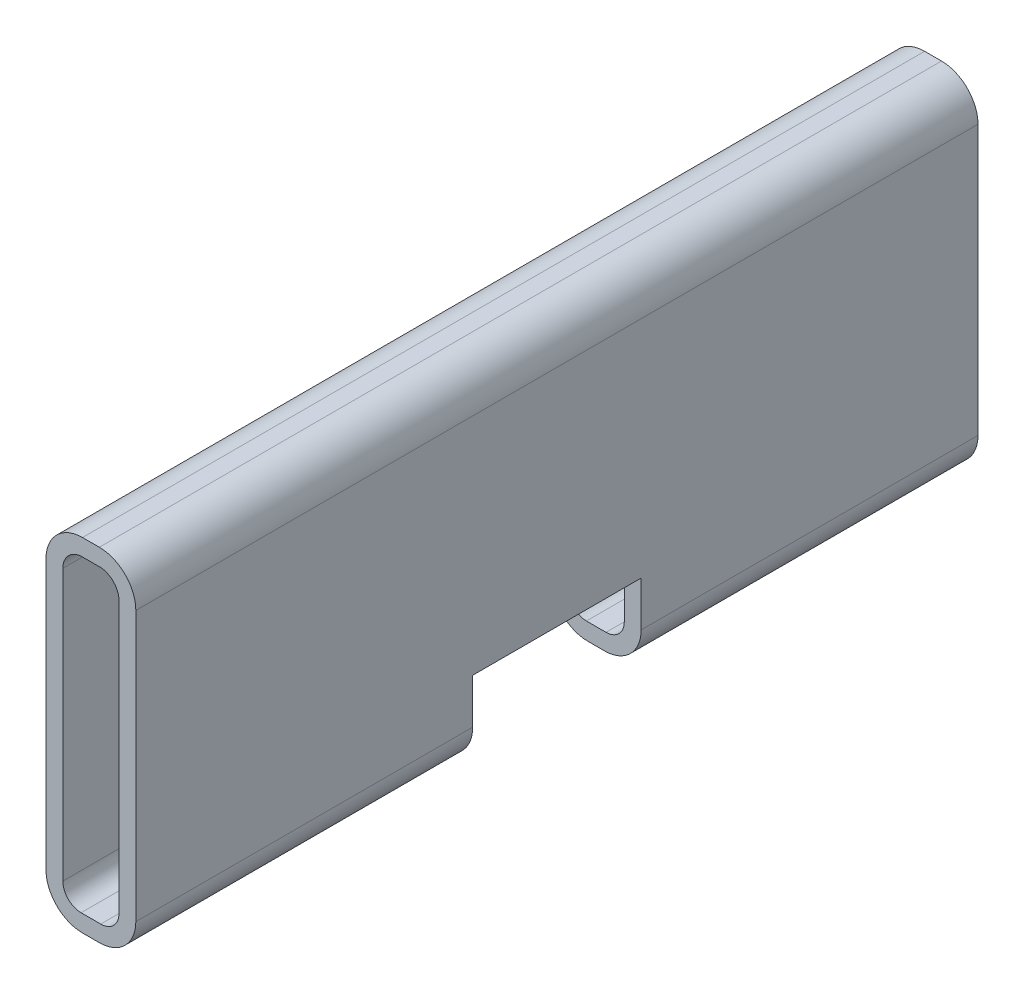
from build123d import *

# Parameters (mm, degrees)
SCHIZZO1_W                   = 16
SCHIZZO1_H                   = 61
SCHIZZO1_W_2                 = 10
SCHIZZO1_H_2                 = 55
ESTRUSIONE_ESTRUSIONE2_DEPTH = 60
RACCORDO1_R                  = 6.5
RACCORDO2_R                  = 3.25
ESTRUSIONE_ESTRUSIONE3_START = 30
ESTRUSIONE_ESTRUSIONE3_DEPTH = 30
ESTRUSIONE_ESTRUSIONE4_START = 60
ESTRUSIONE_ESTRUSIONE4_DEPTH = 60


with BuildPart() as part:
    # Schizzo1 → Estrusione-Estrusione2 (new body)
    with BuildSketch(Plane.XY):
        with Locations((-8, 30.5)):
            Rectangle(SCHIZZO1_W, SCHIZZO1_H)
        with Locations((-8, 30.5)):
            Rectangle(SCHIZZO1_W_2, SCHIZZO1_H_2, mode=Mode.SUBTRACT)
    extrude(amount=ESTRUSIONE_ESTRUSIONE2_DEPTH)

    # Raccordo1
    raccordo1_edges = [part.edges().sort_by_distance(p)[0] for p in [
        (0, 0, 30),
        (-16, 0, 30),
        (-16, 61, 30),
        (0, 61, 30),
    ]]
    fillet(raccordo1_edges, radius=RACCORDO1_R)

    # Raccordo2
    raccordo2_edges = [part.edges().sort_by_distance(p)[0] for p in [
        (-3, 3, 30),
        (-3, 58, 30),
        (-13, 58, 30),
        (-13, 3, 30),
    ]]
    fillet(raccordo2_edges, radius=RACCORDO2_R)

    # Schizzo2 → Estrusione-Estrusione3 (add)
    with BuildSketch(Plane.XY.offset(60).offset(ESTRUSIONE_ESTRUSIONE3_START)):
        with BuildLine():
            Line((-16, 14.5), (-16, 54.5))
            ThreePointArc((-16, 54.5), (-14.096194078, 59.096194078), (-9.5, 61))
            Line((-9.5, 61), (-6.5, 61))
            ThreePointArc((-6.5, 61), (-1.903805922, 59.096194078), (0, 54.5))
            Line((0, 54.5), (0, 14.5))
            Line((0, 14.5), (-3, 14.5))
            Line((-3, 14.5), (-3, 54.5))
            ThreePointArc((-3, 54.5), (-3.937792073, 56.888121647), (-6.25, 58))
            Line((-6.25, 58), (-9.75, 58))
            ThreePointArc((-9.75, 58), (-12.062207927, 56.888121647), (-13, 54.5))
            Line((-13, 54.5), (-13, 14.5))
            Line((-13, 14.5), (-16, 14.5))
        make_face()
    extrude(amount=-ESTRUSIONE_ESTRUSIONE3_DEPTH)

    # Schizzo3 → Estrusione-Estrusione4 (add)
    with BuildSketch(Plane.XY.offset(90).offset(ESTRUSIONE_ESTRUSIONE4_START)):
        with BuildLine():
            Line((-16, 6.5), (-16, 54.5))
            ThreePointArc((-16, 54.5), (-14.096194078, 59.096194078), (-9.5, 61))
            Line((-9.5, 61), (-6.5, 61))
            ThreePointArc((-6.5, 61), (-1.903805922, 59.096194078), (0, 54.5))
            Line((0, 54.5), (0, 6.5))
            ThreePointArc((0, 6.5), (-1.903805922, 1.903805922), (-6.5, 0))
            Line((-6.5, 0), (-9.5, 0))
            ThreePointArc((-9.5, 0), (-14.096194078, 1.903805922), (-16, 6.5))
        make_face()
        with BuildLine():
            Line((-13, 54.5), (-13, 6.25))
            ThreePointArc((-13, 6.25), (-12.048097039, 3.951902961), (-9.75, 3))
            Line((-9.75, 3), (-6.25, 3))
            ThreePointArc((-6.25, 3), (-3.951902961, 3.951902961), (-3, 6.25))
            Line((-3, 6.25), (-3, 54.5))
            ThreePointArc((-3, 54.5), (-3.937792073, 56.888121647), (-6.25, 58))
            Line((-6.25, 58), (-9.75, 58))
            ThreePointArc((-9.75, 58), (-12.062207927, 56.888121647), (-13, 54.5))
        make_face(mode=Mode.SUBTRACT)
    extrude(amount=-ESTRUSIONE_ESTRUSIONE4_DEPTH)


solid = part.part
